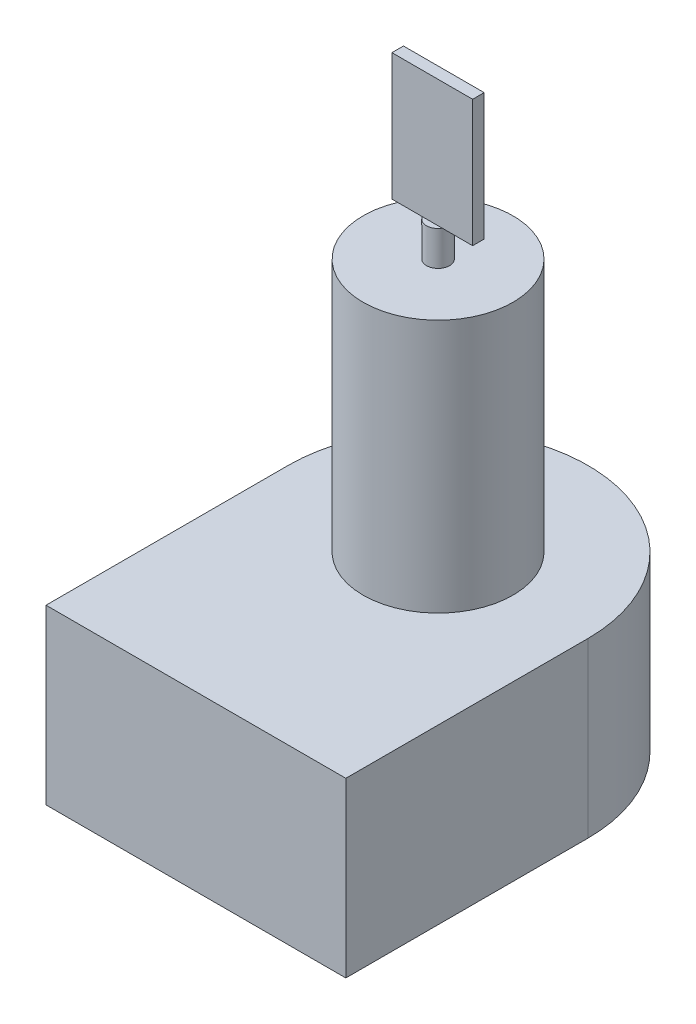
from build123d import *

# Parameters (mm, degrees)
BOSS_EXTRUDE1_DEPTH = 15
SKETCH2_R           = 6.5
BOSS_EXTRUDE2_DEPTH = 22
SKETCH3_R           = 1
BOSS_EXTRUDE3_DEPTH = 3
SKETCH4_W           = 7
SKETCH4_H           = 1
BOSS_EXTRUDE4_DEPTH = 11


with BuildPart() as part:
    # Sketch1 → Boss-Extrude1 (new body)
    with BuildSketch(Plane(origin=(0, 0, 0), x_dir=(1, 0, 0), z_dir=(0, 1, 0))):
        with BuildLine():
            Line((-13, 0), (-13, -21))
            Line((-13, -21), (13, -21))
            Line((13, -21), (13, 0))
            ThreePointArc((13, 0), (0, 13), (-13, 0))
        make_face()
    extrude(amount=BOSS_EXTRUDE1_DEPTH)

    # Sketch2 → Boss-Extrude2 (add)
    with BuildSketch(Plane(origin=(0, 15, 0), x_dir=(1, 0, 0), z_dir=(0, 1, 0))):
        with Locations(Location((0, 0, 0), (0, 0, 270))):
            Circle(SKETCH2_R)
    extrude(amount=BOSS_EXTRUDE2_DEPTH)

    # Sketch3 → Boss-Extrude3 (add)
    with BuildSketch(Plane(origin=(0, 37, 0), x_dir=(1, 0, 0), z_dir=(0, 1, 0))):
        with Locations(Location((0, 0, 0), (0, 0, 270))):
            Circle(SKETCH3_R)
    extrude(amount=BOSS_EXTRUDE3_DEPTH)

    # Sketch4 → Boss-Extrude4 (add)
    with BuildSketch(Plane(origin=(0, 40, 0), x_dir=(1, 0, 0), z_dir=(0, 1, 0))):
        Rectangle(SKETCH4_W, SKETCH4_H)
    extrude(amount=BOSS_EXTRUDE4_DEPTH)


solid = part.part
